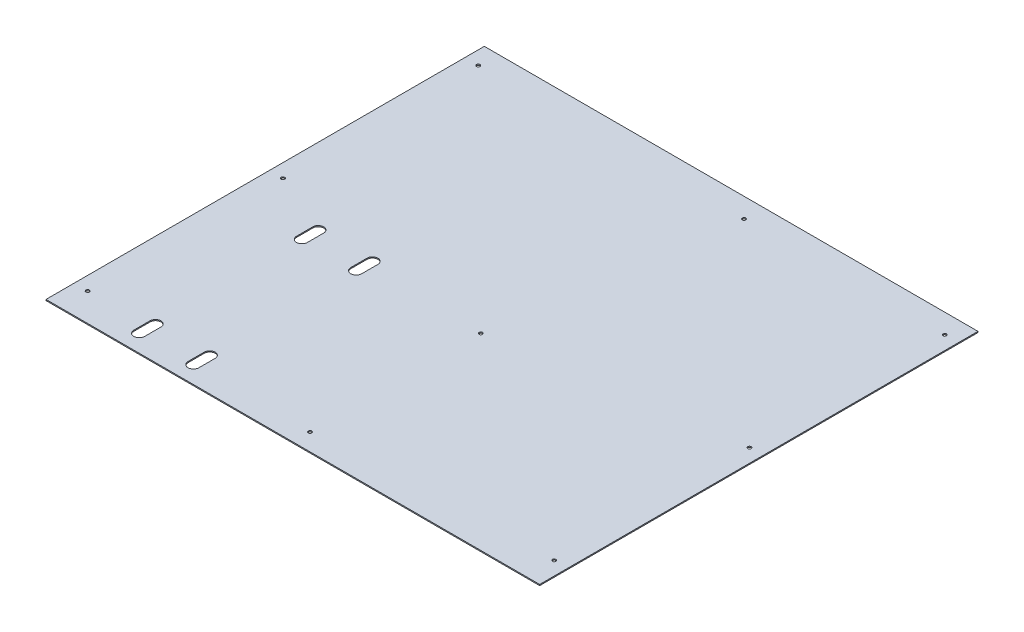
from build123d import *

# Parameters (mm, degrees)
CROQUIS1_W              = 455
CROQUIS1_H              = 409
SALIENTE_EXTRUIR1_DEPTH = 1
CORTAR_EXTRUIR1_REACH   = 307.904
CROQUIS2_R              = 1.6
CORTAR_EXTRUIR2_REACH   = 307.904
CROQUIS3_R              = 5
CORTAR_EXTRUIR3_REACH   = 307.904
CROQUIS4_R              = 1.6
MOVER_CARA1_BY          = 5
CORTAR_EXTRUIR4_DEPTH   = 10


with BuildPart() as part:
    # Croquis1 → Saliente-Extruir1 (new body)
    with BuildSketch(Plane(origin=(0, 0, 0), x_dir=(1, 0, 0), z_dir=(0, 1, 0))):
        Rectangle(CROQUIS1_W, CROQUIS1_H)
    extrude(amount=SALIENTE_EXTRUIR1_DEPTH)

    # Croquis2 → Cortar-Extruir1 (cut, up to next)
    with BuildSketch(Plane.XZ, mode=Mode.PRIVATE) as cortar_extruir1_sk1:
        with Locations(Location((-215, 178.6, 0), (0, 0, 270))):
            Circle(CROQUIS2_R)
    cortar_extruir1_tool1 = extrude(cortar_extruir1_sk1.sketch, amount=-CORTAR_EXTRUIR1_REACH, mode=Mode.PRIVATE) & part.part
    # Croquis2 → Cortar-Extruir1 (cut, up to next)
    with BuildSketch(Plane.XZ, mode=Mode.PRIVATE) as cortar_extruir1_sk2:
        with Locations(Location((-215, -181.4, 0), (0, 0, 270))):
            Circle(CROQUIS2_R)
    cortar_extruir1_tool2 = extrude(cortar_extruir1_sk2.sketch, amount=-CORTAR_EXTRUIR1_REACH, mode=Mode.PRIVATE) & part.part
    # Croquis2 → Cortar-Extruir1 (cut, up to next)
    with BuildSketch(Plane.XZ, mode=Mode.PRIVATE) as cortar_extruir1_sk3:
        with Locations(Location((215, -181.4, 0), (0, 0, 270))):
            Circle(CROQUIS2_R)
    cortar_extruir1_tool3 = extrude(cortar_extruir1_sk3.sketch, amount=-CORTAR_EXTRUIR1_REACH, mode=Mode.PRIVATE) & part.part
    # Croquis2 → Cortar-Extruir1 (cut, up to next)
    with BuildSketch(Plane.XZ, mode=Mode.PRIVATE) as cortar_extruir1_sk4:
        with Locations(Location((215, 178.6, 0), (0, 0, 270))):
            Circle(CROQUIS2_R)
    cortar_extruir1_tool4 = extrude(cortar_extruir1_sk4.sketch, amount=-CORTAR_EXTRUIR1_REACH, mode=Mode.PRIVATE) & part.part
    # Croquis2 → Cortar-Extruir1 (cut, up to next)
    with BuildSketch(Plane.XZ, mode=Mode.PRIVATE) as cortar_extruir1_sk5:
        with Locations(Location((0, 31.25, 0), (0, 0, 270))):
            Circle(CROQUIS2_R)
    cortar_extruir1_tool5 = extrude(cortar_extruir1_sk5.sketch, amount=-CORTAR_EXTRUIR1_REACH, mode=Mode.PRIVATE) & part.part
    add(cortar_extruir1_tool1.solids().sort_by_distance((-215, 0, 178.6))[0], mode=Mode.SUBTRACT)
    add(cortar_extruir1_tool2.solids().sort_by_distance((-215, 0, -181.4))[0], mode=Mode.SUBTRACT)
    add(cortar_extruir1_tool3.solids().sort_by_distance((215, 0, -181.4))[0], mode=Mode.SUBTRACT)
    add(cortar_extruir1_tool4.solids().sort_by_distance((215, 0, 178.6))[0], mode=Mode.SUBTRACT)
    add(cortar_extruir1_tool5.solids().sort_by_distance((0, 0, 31.25))[0], mode=Mode.SUBTRACT)

    # Croquis3 → Cortar-Extruir2 (cut, up to next)
    with BuildSketch(Plane.XZ, mode=Mode.PRIVATE) as cortar_extruir2_sk1:
        with Locations(Location((-157.5, 38.6, 0), (0, 0, 270))):
            Circle(CROQUIS3_R)
    cortar_extruir2_tool1 = extrude(cortar_extruir2_sk1.sketch, amount=-CORTAR_EXTRUIR2_REACH, mode=Mode.PRIVATE) & part.part
    # Croquis3 → Cortar-Extruir2 (cut, up to next)
    with BuildSketch(Plane.XZ, mode=Mode.PRIVATE) as cortar_extruir2_sk2:
        with Locations(Location((-107.5, 38.6, 0), (0, 0, 270))):
            Circle(CROQUIS3_R)
    cortar_extruir2_tool2 = extrude(cortar_extruir2_sk2.sketch, amount=-CORTAR_EXTRUIR2_REACH, mode=Mode.PRIVATE) & part.part
    # Croquis3 → Cortar-Extruir2 (cut, up to next)
    with BuildSketch(Plane.XZ, mode=Mode.PRIVATE) as cortar_extruir2_sk3:
        with Locations(Location((-107.5, 188.6, 0), (0, 0, 270))):
            Circle(CROQUIS3_R)
    cortar_extruir2_tool3 = extrude(cortar_extruir2_sk3.sketch, amount=-CORTAR_EXTRUIR2_REACH, mode=Mode.PRIVATE) & part.part
    # Croquis3 → Cortar-Extruir2 (cut, up to next)
    with BuildSketch(Plane.XZ, mode=Mode.PRIVATE) as cortar_extruir2_sk4:
        with Locations(Location((-157.5, 188.6, 0), (0, 0, 270))):
            Circle(CROQUIS3_R)
    cortar_extruir2_tool4 = extrude(cortar_extruir2_sk4.sketch, amount=-CORTAR_EXTRUIR2_REACH, mode=Mode.PRIVATE) & part.part
    add(cortar_extruir2_tool1.solids().sort_by_distance((-157.5, 0, 38.6))[0], mode=Mode.SUBTRACT)
    add(cortar_extruir2_tool2.solids().sort_by_distance((-107.5, 0, 38.6))[0], mode=Mode.SUBTRACT)
    add(cortar_extruir2_tool3.solids().sort_by_distance((-107.5, 0, 188.6))[0], mode=Mode.SUBTRACT)
    add(cortar_extruir2_tool4.solids().sort_by_distance((-157.5, 0, 188.6))[0], mode=Mode.SUBTRACT)

    # Croquis4 → Cortar-Extruir3 (cut, up to next)
    with BuildSketch(Plane.XZ, mode=Mode.PRIVATE) as cortar_extruir3_sk1:
        with Locations(Location((-215, -1.4, 0), (0, 0, 270))):
            Circle(CROQUIS4_R)
    cortar_extruir3_tool1 = extrude(cortar_extruir3_sk1.sketch, amount=-CORTAR_EXTRUIR3_REACH, mode=Mode.PRIVATE) & part.part
    # Croquis4 → Cortar-Extruir3 (cut, up to next)
    with BuildSketch(Plane.XZ, mode=Mode.PRIVATE) as cortar_extruir3_sk2:
        with Locations(Location((215, -1.4, 0), (0, 0, 270))):
            Circle(CROQUIS4_R)
    cortar_extruir3_tool2 = extrude(cortar_extruir3_sk2.sketch, amount=-CORTAR_EXTRUIR3_REACH, mode=Mode.PRIVATE) & part.part
    # Croquis4 → Cortar-Extruir3 (cut, up to next)
    with BuildSketch(Plane.XZ, mode=Mode.PRIVATE) as cortar_extruir3_sk3:
        with Locations(Location((0, 188.6, 0), (0, 0, 270))):
            Circle(CROQUIS4_R)
    cortar_extruir3_tool3 = extrude(cortar_extruir3_sk3.sketch, amount=-CORTAR_EXTRUIR3_REACH, mode=Mode.PRIVATE) & part.part
    # Croquis4 → Cortar-Extruir3 (cut, up to next)
    with BuildSketch(Plane.XZ, mode=Mode.PRIVATE) as cortar_extruir3_sk4:
        with Locations(Location((30, -181.4, 0), (0, 0, 270))):
            Circle(CROQUIS4_R)
    cortar_extruir3_tool4 = extrude(cortar_extruir3_sk4.sketch, amount=-CORTAR_EXTRUIR3_REACH, mode=Mode.PRIVATE) & part.part
    add(cortar_extruir3_tool1.solids().sort_by_distance((-215, 0, -1.4))[0], mode=Mode.SUBTRACT)
    add(cortar_extruir3_tool2.solids().sort_by_distance((215, 0, -1.4))[0], mode=Mode.SUBTRACT)
    add(cortar_extruir3_tool3.solids().sort_by_distance((0, 0, 188.6))[0], mode=Mode.SUBTRACT)
    add(cortar_extruir3_tool4.solids().sort_by_distance((30, 0, -181.4))[0], mode=Mode.SUBTRACT)

    # Mover cara1: a face moved inward by 5.0
    extrude(part.faces().sort_by_distance((0, 0.5, -204.5))[0], amount=MOVER_CARA1_BY, dir=(0, 0, 1), mode=Mode.SUBTRACT)

    # Croquis5 → Cortar-Extruir4 (cut)
    with BuildSketch(Plane.XZ):
        with BuildLine():
            Line((-162.5, 173.6), (-162.5, 188.6))
            ThreePointArc((-162.5, 188.6), (-157.5, 193.6), (-152.5, 188.6))
            Line((-152.5, 188.6), (-152.5, 173.6))
            ThreePointArc((-152.5, 173.6), (-157.5, 168.6), (-162.5, 173.6))
        make_face()
        with BuildLine():
            Line((-112.5, 173.6), (-112.5, 188.6))
            ThreePointArc((-112.5, 188.6), (-107.5, 193.6), (-102.5, 188.6))
            Line((-102.5, 188.6), (-102.5, 173.6))
            ThreePointArc((-102.5, 173.6), (-107.5, 168.6), (-112.5, 173.6))
        make_face()
        with BuildLine():
            Line((-162.5, 23.6), (-162.5, 38.6))
            ThreePointArc((-162.5, 38.6), (-157.5, 43.6), (-152.5, 38.6))
            Line((-152.5, 38.6), (-152.5, 23.6))
            ThreePointArc((-152.5, 23.6), (-157.5, 18.6), (-162.5, 23.6))
        make_face()
        with BuildLine():
            Line((-112.5, 23.6), (-112.5, 38.6))
            ThreePointArc((-112.5, 38.6), (-107.5, 43.6), (-102.5, 38.6))
            Line((-102.5, 38.6), (-102.5, 23.6))
            ThreePointArc((-102.5, 23.6), (-107.5, 18.6), (-112.5, 23.6))
        make_face()
    extrude(amount=-CORTAR_EXTRUIR4_DEPTH, mode=Mode.SUBTRACT)


solid = part.part
